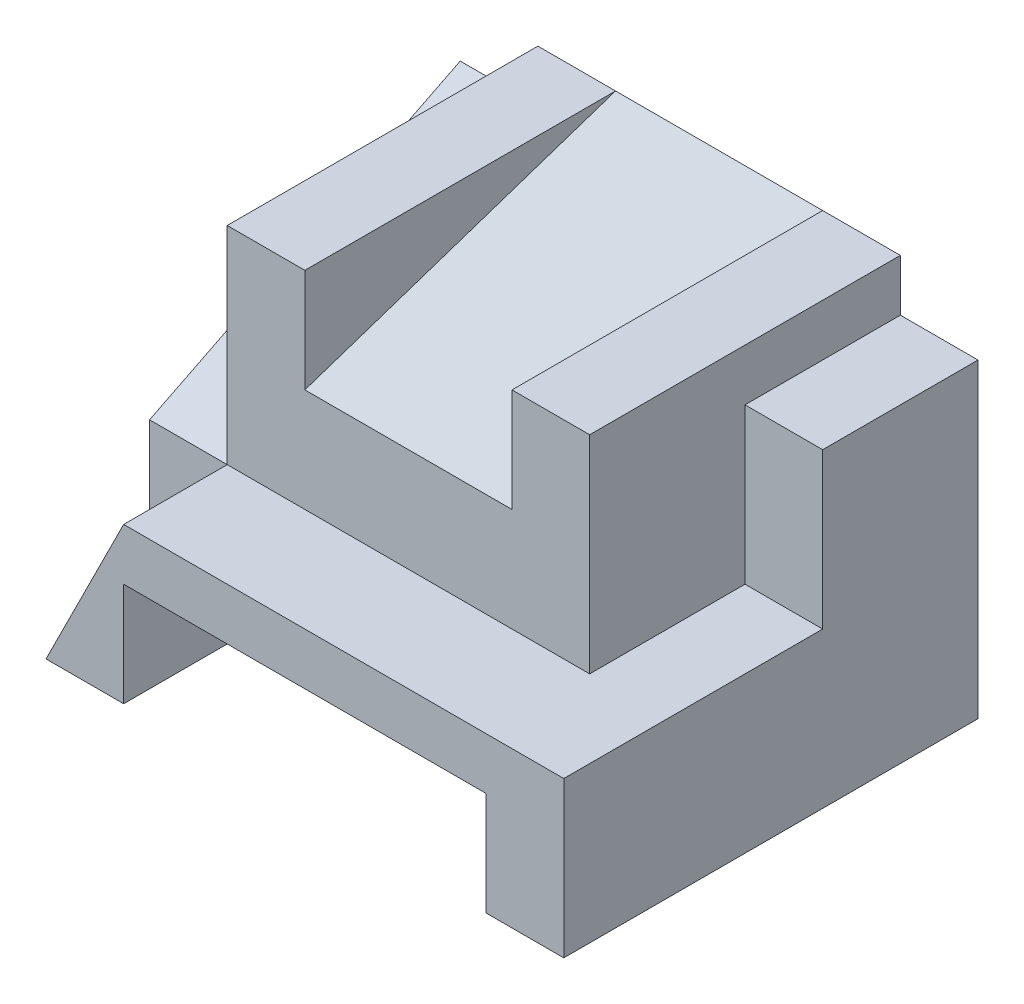
from build123d import *

# Parameters (mm, degrees)
SALIENTE_EXTRUIR1_DEPTH = 8
CORTAR_EXTRUIR2_DEPTH   = 2
CROQUIS3_W              = 7
CROQUIS3_H              = 4
SALIENTE_EXTRUIR2_DEPTH = 6
CROQUIS4_W              = 4
CROQUIS4_H              = 6
CORTAR_EXTRUIR3_DEPTH   = 2
SALIENTE_EXTRUIR3_DEPTH = 4
SALIENTE_EXTRUIR4_DEPTH = 1.5
CROQUIS7_W              = 1.5
CROQUIS7_H              = 3
SALIENTE_EXTRUIR5_DEPTH = 3


with BuildPart() as part:
    # Croquis1 → Saliente-Extruir1 (new body)
    with BuildSketch(Plane.XY):
        Polygon((-3.5, 0), (-5, 0), (-5, 3), (5, 3), (5, 0), (3.5, 0), (3.5, 2), (-3.5, 2), align=None)
    extrude(amount=-SALIENTE_EXTRUIR1_DEPTH)

    # Croquis2 → Cortar-Extruir2 (cut)
    with BuildSketch(Plane.XY):
        Polygon((-5, 0), (-3.5, 3), (-5, 3), align=None)
    extrude(amount=-CORTAR_EXTRUIR2_DEPTH, mode=Mode.SUBTRACT)

    # Croquis3 → Saliente-Extruir2 (add)
    with BuildSketch(Plane.XY.offset(-2)):
        with Locations((0, 5)):
            Rectangle(CROQUIS3_W, CROQUIS3_H)
    extrude(amount=-SALIENTE_EXTRUIR2_DEPTH)

    # Croquis4 → Cortar-Extruir3 (cut)
    with BuildSketch(Plane(origin=(0, 7, 0), x_dir=(1, 0, 0), z_dir=(0, 1, 0))):
        with Locations((0, 5)):
            Rectangle(CROQUIS4_W, CROQUIS4_H)
    extrude(amount=-CORTAR_EXTRUIR3_DEPTH, mode=Mode.SUBTRACT)

    # Croquis5 → Saliente-Extruir3 (add)
    with BuildSketch(Plane.ZY.offset(-2)):
        Polygon((-8, 7), (-2, 5), (-8, 5), align=None)
    extrude(amount=SALIENTE_EXTRUIR3_DEPTH)

    # Croquis6 → Saliente-Extruir4 (add)
    with BuildSketch(Plane.ZY.offset(3.5)):
        Polygon((-8, 6), (-2, 3), (-8, 3), align=None)
    extrude(amount=SALIENTE_EXTRUIR4_DEPTH)

    # Croquis7 → Saliente-Extruir5 (add)
    with BuildSketch(Plane(origin=(0, 3, 0), x_dir=(1, 0, 0), z_dir=(0, 1, 0))):
        with Locations((4.25, 6.5)):
            Rectangle(CROQUIS7_W, CROQUIS7_H)
    extrude(amount=SALIENTE_EXTRUIR5_DEPTH)


solid = part.part
